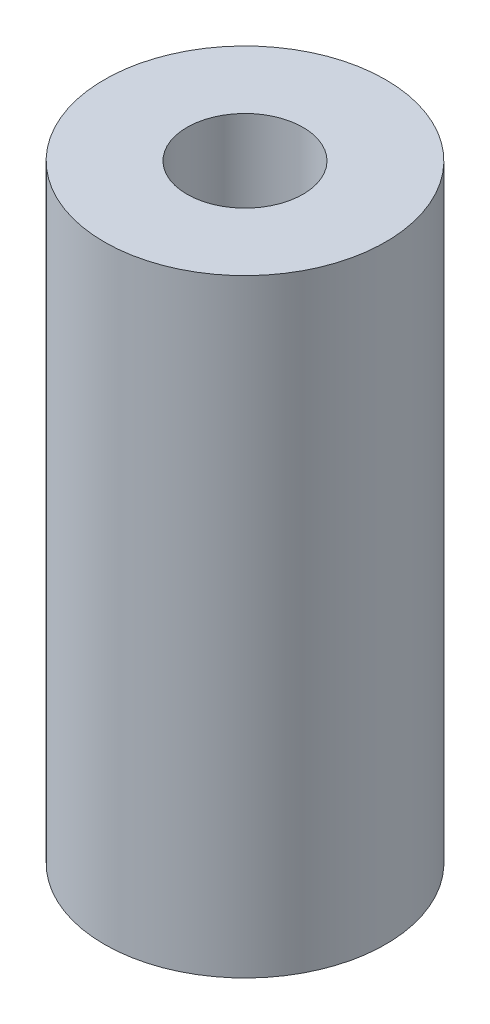
from build123d import *

# Parameters (mm, degrees)
SKETCH_1_R      = 4
SKETCH_1_R_2    = 1.65
EXTRUDE_1_DEPTH = 17.3


with BuildPart() as part:
    # ｽｹｯﾁ1 → ﾎﾞｽ - 押し出し1 (new body)
    with BuildSketch(Plane(origin=(0, 0, 0), x_dir=(1, 0, 0), z_dir=(0, 1, 0))):
        with Locations(Location((0, 0, 0), (0, 0, 270))):
            Circle(SKETCH_1_R)
        with Locations(Location((0, 0, 0), (0, 0, 270))):
            Circle(SKETCH_1_R_2, mode=Mode.SUBTRACT)
    extrude(amount=EXTRUDE_1_DEPTH)


solid = part.part
